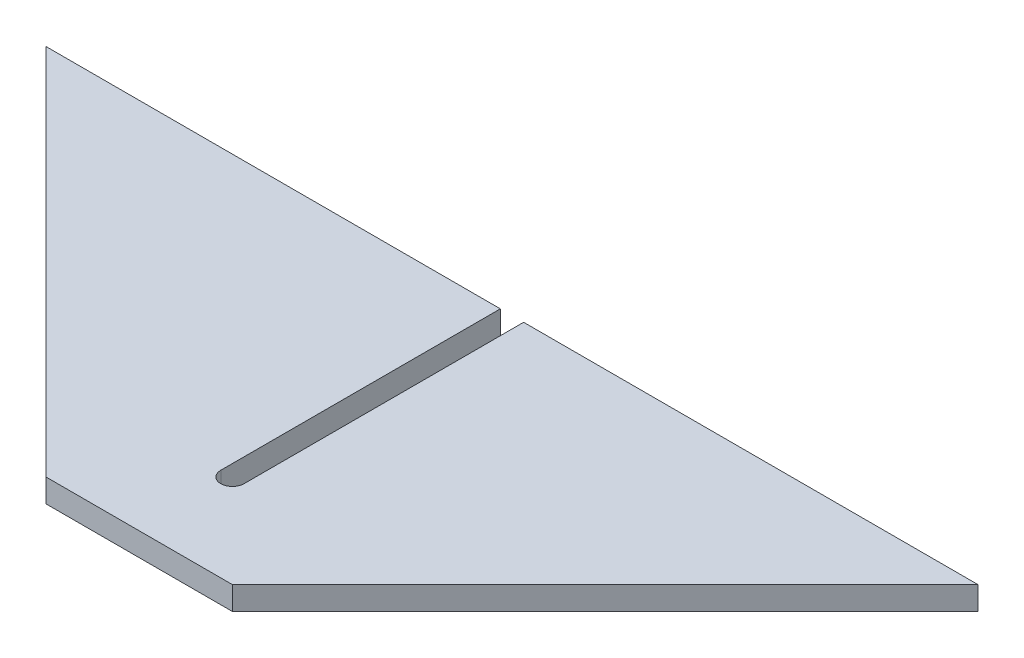
from build123d import *

# Parameters (mm, degrees)
BOSS_EXTRUDE1_DEPTH = 6.35


with BuildPart() as part:
    # Sketch1 → Boss-Extrude1 (new body)
    with BuildSketch(Plane(origin=(0, 0, 0), x_dir=(1, 0, 0), z_dir=(0, 1, 0))):
        Polygon((-127, 50.8), (-25.4, 50.8), (-25.4, -50.8), align=None)
        with BuildLine():
            Line((-25.4, 50.8), (-25.4, -50.8))
            Line((-25.4, -50.8), (25.4, -50.8))
            Line((25.4, -50.8), (25.4, 50.8))
            Line((25.4, 50.8), (3.175, 50.8))
            Line((3.175, 50.8), (3.175, -25.4))
            ThreePointArc((3.175, -25.4), (0, -28.575), (-3.175, -25.4))
            Line((-3.175, -25.4), (-3.175, 50.8))
            Line((-3.175, 50.8), (-25.4, 50.8))
        make_face()
        Polygon((25.4, -50.8), (127, 50.8), (25.4, 50.8), align=None)
    extrude(amount=BOSS_EXTRUDE1_DEPTH)


solid = part.part
